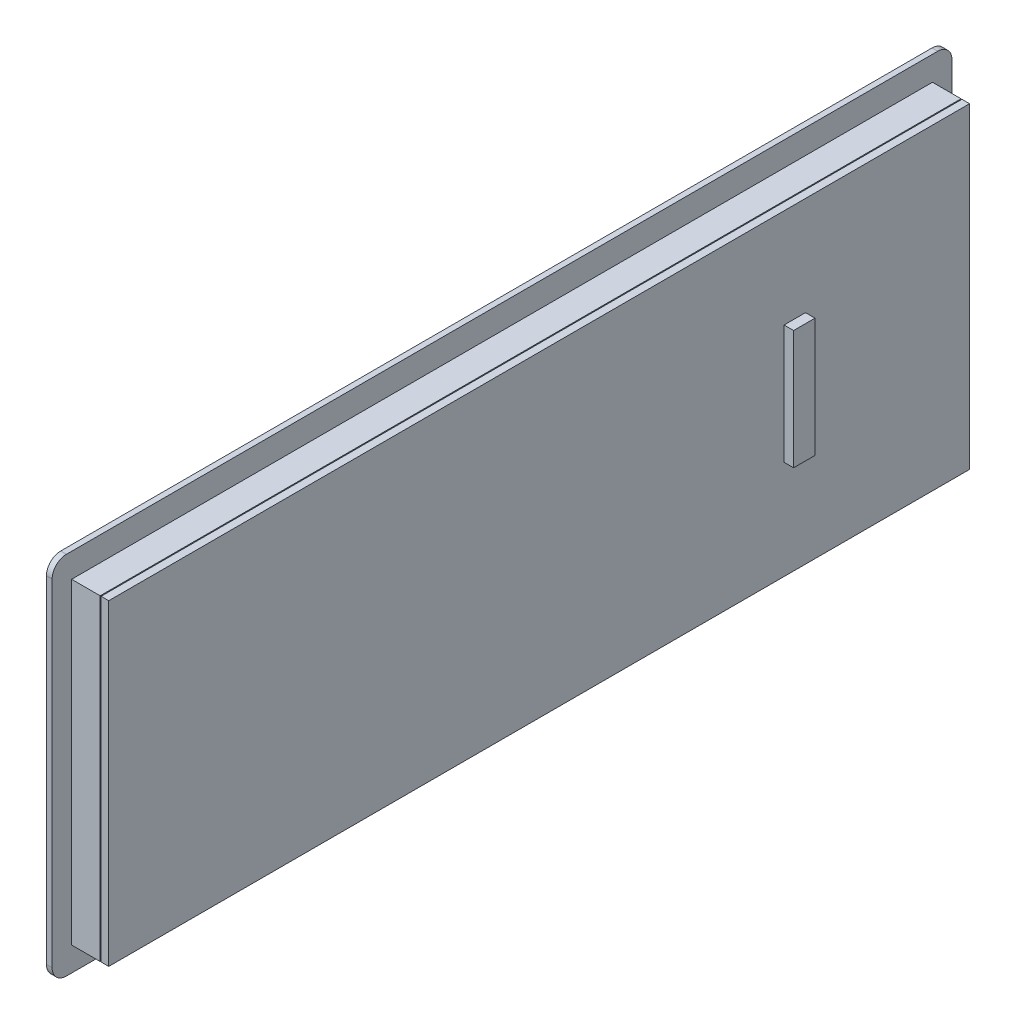
from build123d import *

# Parameters (mm, degrees)
EXTRUDE_1_DEPTH     = 1.2
SKETCH_2_W          = 181
SKETCH_2_H          = 66.6
EXTRUDE_2_DEPTH     = 6
SKETCH_3_W          = 175.952774737
SKETCH_3_H          = 62.140674221
EXTRUDE_3_DEPTH     = 0.2
SKETCH_4_W          = 181
SKETCH_4_H          = 66.6
EXTRUDE_4_DEPTH     = 1.6
SKETCH_5_W          = 161.4
SKETCH_5_H          = 61.02
CUT_EXTRUDE_1_DEPTH = 0.01
SKETCH_7_W          = 4.5
SKETCH_7_H          = 25
EXTRUDE_5_DEPTH     = 2


with BuildPart() as part:
    # Эскиз1 (on Right Plane) → Бобышка-Вытянуть1 (new body)
    with BuildSketch(Plane(origin=(0, 0, 0), x_dir=(0, 0, -1), z_dir=(1, 0, 0))):
        with BuildLine():
            Line((91.6, -38.4), (-91.6, -38.4))
            ThreePointArc((-91.6, -38.4), (-93.721320344, -37.521320344), (-94.6, -35.4))
            Line((-94.6, -35.4), (-94.6, 35.4))
            ThreePointArc((-94.6, 35.4), (-93.721320344, 37.521320344), (-91.6, 38.4))
            Line((-91.6, 38.4), (91.6, 38.4))
            ThreePointArc((91.6, 38.4), (93.721320344, 37.521320344), (94.6, 35.4))
            Line((94.6, 35.4), (94.6, -35.4))
            ThreePointArc((94.6, -35.4), (93.721320344, -37.521320344), (91.6, -38.4))
        make_face()
    extrude(amount=EXTRUDE_1_DEPTH)

    # Эскиз2 → Бобышка-Вытянуть2 (add)
    with BuildSketch(Plane(origin=(1.2, 0, 0), x_dir=(0, 0, -1), z_dir=(1, 0, 0))):
        Rectangle(SKETCH_2_W, SKETCH_2_H)
    extrude(amount=EXTRUDE_2_DEPTH)

    # Эскиз3 → Бобышка-Вытянуть3 (add)
    with BuildSketch(Plane(origin=(7.2, 0, 0), x_dir=(0, 0, -1), z_dir=(1, 0, 0))):
        with Locations((0.437545425, -0.270444937)):
            Rectangle(SKETCH_3_W, SKETCH_3_H)
    extrude(amount=EXTRUDE_3_DEPTH)

    # Эскиз4 → Бобышка-Вытянуть4 (add)
    with BuildSketch(Plane(origin=(7.4, 0, 0), x_dir=(0, 0, -1), z_dir=(1, 0, 0))):
        Rectangle(SKETCH_4_W, SKETCH_4_H)
    extrude(amount=EXTRUDE_4_DEPTH)

    # Эскиз5 → Вырез-Вытянуть1 (cut)
    with BuildSketch(Plane.ZY):
        Rectangle(SKETCH_5_W, SKETCH_5_H)
    extrude(amount=-CUT_EXTRUDE_1_DEPTH, mode=Mode.SUBTRACT)

    # Эскиз7 → Бобышка-Вытянуть5 (add)
    with BuildSketch(Plane(origin=(9, 0, 0), x_dir=(0, 0, -1), z_dir=(1, 0, 0))):
        with Locations((53.75, 0)):
            Rectangle(SKETCH_7_W, SKETCH_7_H)
    extrude(amount=EXTRUDE_5_DEPTH)


solid = part.part
